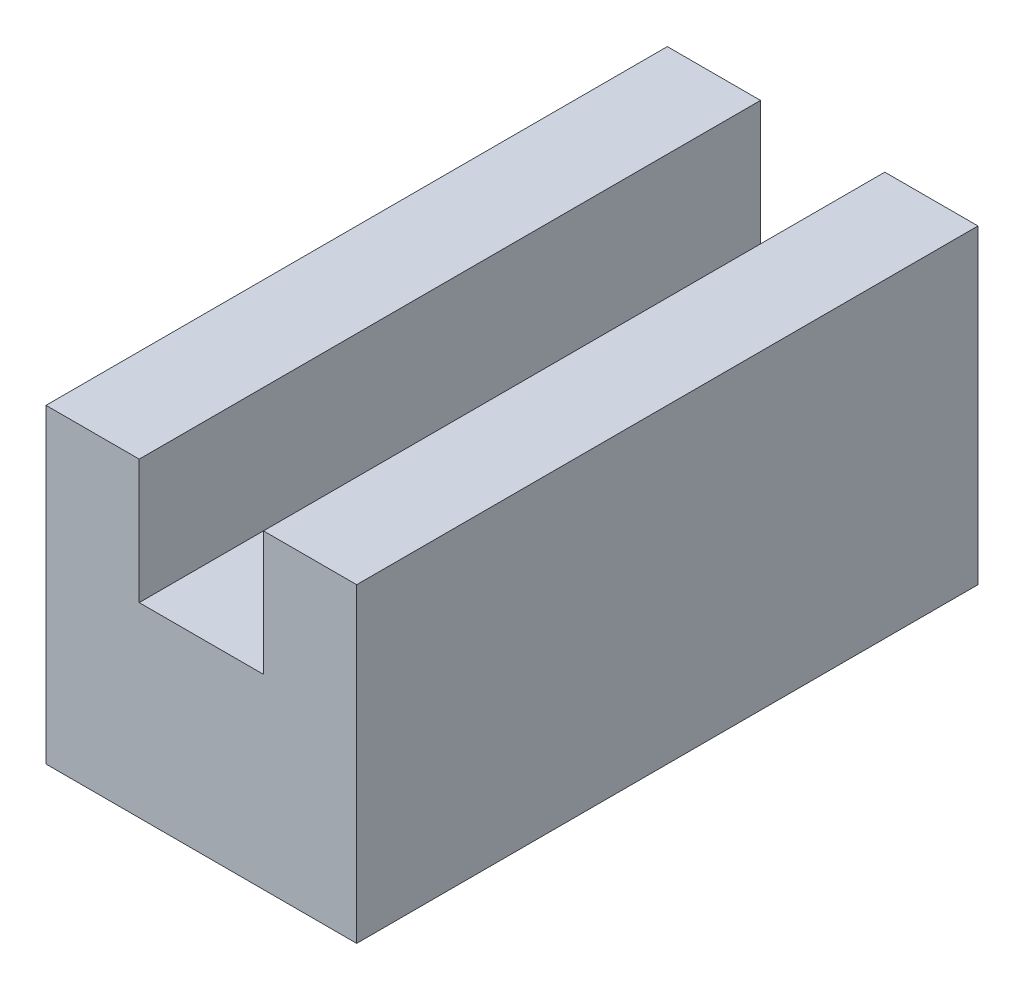
from build123d import *

# Parameters (mm, degrees)
SKETCH1_W           = 5
SKETCH1_H           = 5
BOSS_EXTRUDE1_DEPTH = 10
SKETCH2_W           = 2
SKETCH2_H           = 10
CUT_EXTRUDE1_DEPTH  = 2


with BuildPart() as part:
    # Sketch1 → Boss-Extrude1 (new body)
    with BuildSketch(Plane.XY):
        with Locations((2.5, 2.5)):
            Rectangle(SKETCH1_W, SKETCH1_H)
    extrude(amount=BOSS_EXTRUDE1_DEPTH)

    # Sketch2 → Cut-Extrude1 (cut)
    with BuildSketch(Plane(origin=(0, 5, 0), x_dir=(1, 0, 0), z_dir=(0, 1, 0))):
        with Locations((2.5, -5)):
            Rectangle(SKETCH2_W, SKETCH2_H)
    extrude(amount=-CUT_EXTRUDE1_DEPTH, mode=Mode.SUBTRACT)


solid = part.part
